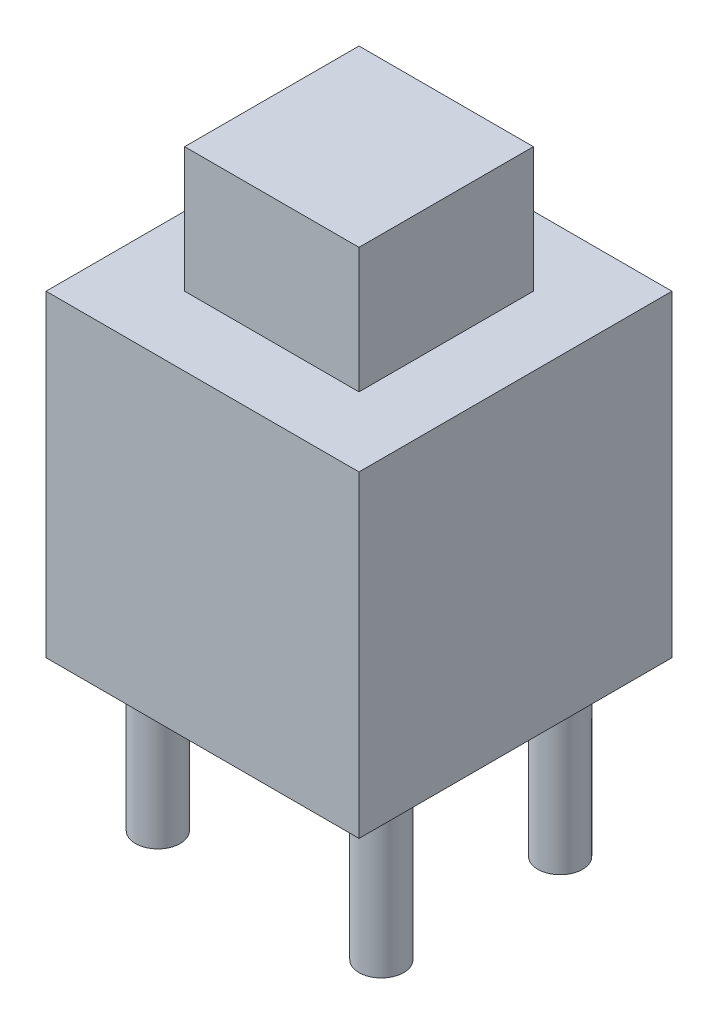
from build123d import *

# Parameters (mm, degrees)
SKETCH_1_W      = 7
SKETCH_1_H      = 7
EXTRUDE_1_DEPTH = 7.1
SKETCH_2_W      = 3.9
SKETCH_2_H      = 3.9
EXTRUDE_2_DEPTH = 2.8
SKETCH_3_R      = 0.5
EXTRUDE_3_DEPTH = 3.6


with BuildPart() as part:
    # 草图1 → 凸台-拉伸1 (new body)
    with BuildSketch(Plane(origin=(0, 0, 0), x_dir=(1, 0, 0), z_dir=(0, 1, 0))):
        with Locations((3.5, 3.5)):
            Rectangle(SKETCH_1_W, SKETCH_1_H)
    extrude(amount=EXTRUDE_1_DEPTH)

    # 草图2 → 凸台-拉伸2 (add)
    with BuildSketch(Plane(origin=(0, 7.1, 0), x_dir=(1, 0, 0), z_dir=(0, 1, 0))):
        with Locations((3.5, 3.5)):
            Rectangle(SKETCH_2_W, SKETCH_2_H)
    extrude(amount=EXTRUDE_2_DEPTH)

    # 草图3 → 凸台-拉伸3 (add)
    with BuildSketch(Plane.XZ):
        with Locations(Location((1, -1.5, 0), (0, 0, 270))):
            Circle(SKETCH_3_R)
        with Locations(Location((6, -1.5, 0), (0, 0, 270))):
            Circle(SKETCH_3_R)
        with Locations(Location((6, -5.5, 0), (0, 0, 270))):
            Circle(SKETCH_3_R)
        with Locations(Location((1, -5.5, 0), (0, 0, 270))):
            Circle(SKETCH_3_R)
    extrude(amount=EXTRUDE_3_DEPTH)


solid = part.part
